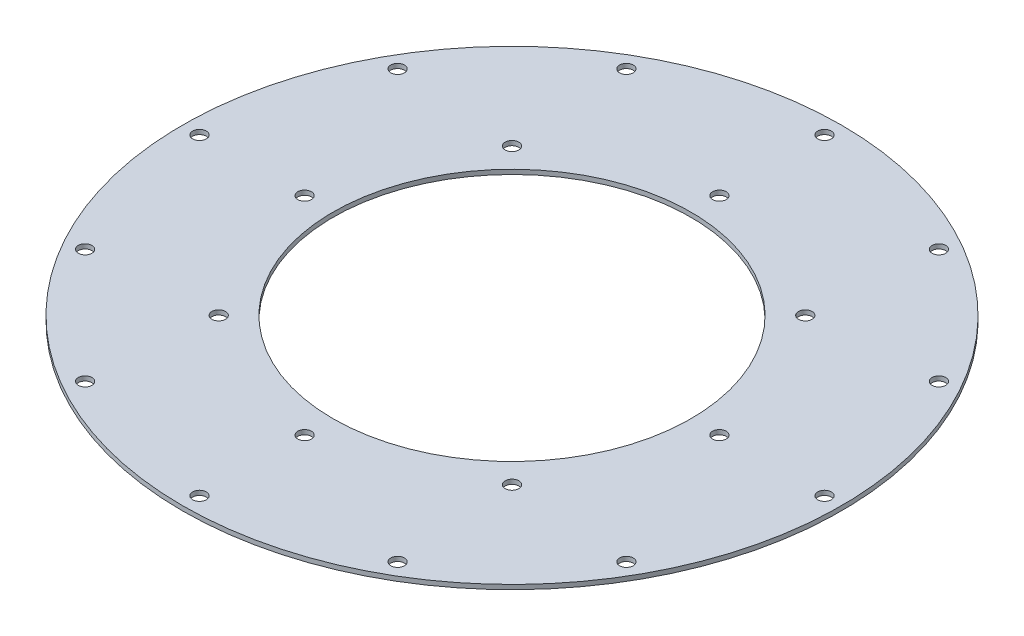
from build123d import *

# Parameters (mm, degrees)
SKETCH1_R           = 290
SKETCH1_R_2         = 157.5
BOSS_EXTRUDE1_DEPTH = 4
SKETCH2_R           = 6
CUT_EXTRUDE1_DEPTH  = 4
CIRPATTERN1_COUNT   = 8
SKETCH3_R           = 6
CUT_EXTRUDE2_DEPTH  = 4
CIRPATTERN2_COUNT   = 12


with BuildPart() as part:
    # Sketch1 → Boss-Extrude1 (new body)
    with BuildSketch(Plane(origin=(0, 0, 0), x_dir=(1, 0, 0), z_dir=(0, 1, 0))):
        with Locations(Location((0, 0, 0), (0, 0, 270))):
            Circle(SKETCH1_R)
        with Locations(Location((0, 0, 0), (0, 0, 270))):
            Circle(SKETCH1_R_2, mode=Mode.SUBTRACT)
    extrude(amount=BOSS_EXTRUDE1_DEPTH)

    # Sketch2 → Cut-Extrude1 (cut)
    with BuildSketch(Plane(origin=(0, 4, 0), x_dir=(1, 0, 0), z_dir=(0, 1, 0))):
        with Locations(Location((182.5, 0, 0), (0, 0, 270))):
            Circle(SKETCH2_R)
    cut_extrude1 = extrude(amount=-CUT_EXTRUDE1_DEPTH, mode=Mode.SUBTRACT)

    # CirPattern1: Cut-Extrude1 ×8 about axis
    cirpattern1_axis = Axis((0, 0, 0), (0, 1, 0))
    for i in range(1, CIRPATTERN1_COUNT):
        add(cut_extrude1.rotate(cirpattern1_axis, i * 360 / CIRPATTERN1_COUNT), mode=Mode.SUBTRACT)

    # Sketch3 → Cut-Extrude2 (cut)
    with BuildSketch(Plane(origin=(0, 4, 0), x_dir=(1, 0, 0), z_dir=(0, 1, 0))):
        with Locations(Location((275, 0, 0), (0, 0, 270))):
            Circle(SKETCH3_R)
    cut_extrude2 = extrude(amount=-CUT_EXTRUDE2_DEPTH, mode=Mode.SUBTRACT)

    # CirPattern2: Cut-Extrude2 ×12 about axis
    cirpattern2_axis = Axis((0, 0, 0), (0, 1, 0))
    for i in range(1, CIRPATTERN2_COUNT):
        add(cut_extrude2.rotate(cirpattern2_axis, i * 360 / CIRPATTERN2_COUNT), mode=Mode.SUBTRACT)


solid = part.part
